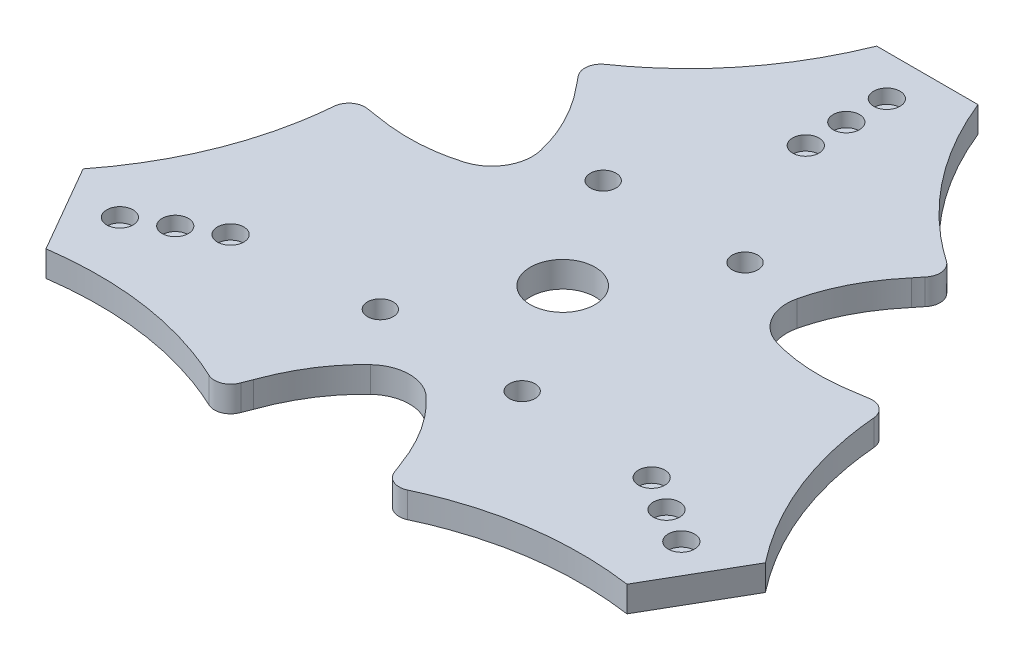
from build123d import *

# Parameters (mm, degrees)
CROQUIS2_R            = 16
DELTA_BASE_DEPTH      = 12.7
CROQUIS3_R            = 3
CORTAR_EXTRUIR2_DEPTH = 30
CROQUIS5_R            = 6.5
CORTAR_EXTRUIR3_DEPTH = 7
CROQUIS6_R            = 6.35
CORTAR_EXTRUIR4_DEPTH = 38


with BuildPart() as part:
    # Croquis2 → Delta Base (new body)
    with BuildSketch(Plane(origin=(0, 0, 0), x_dir=(1, 0, 0), z_dir=(0, 1, 0))):
        with BuildLine():
            Line((168.384572854, -68.349364766), (143.384572854, -111.650634955))
            add(Edge.make_bspline(
                [(143.384572854, -111.650634955), (110.228964472, -106.994880788), (78.165264136, -111.818792753), (48.966207304, -125.543555732)],
                knots=[0, 0, 0, 0, 0.911575674, 0.911575674, 0.911575674, 0.911575674], degree=3))
            ThreePointArc((48.966207304, -125.543555732), (42.399289585, -125.651302831), (37.964762468, -120.806616359))
            add(Edge.make_bspline(
                [(36.219139152, -116.360829974), (36.873200125, -117.787733164), (37.457762294, -119.267608258), (37.964762468, -120.806616359)],
                knots=[0.875206919, 0.875206919, 0.875206919, 0.875206919, 0.919288331, 0.919288331, 0.919288331, 0.919288331], degree=3))
            add(Edge.make_bspline(
                [(36.219139152, -116.360829974), (31.103863708, -102.135589346), (23.600584995, -90.366962092), (13.709301605, -81.054947485)],
                knots=[0, 0, 0, 0, 0.49880396, 0.49880396, 0.49880396, 0.49880396], degree=3))
            ThreePointArc((13.709301605, -81.054947485), (4.34e-07, -75.617057833), (-13.709300808, -81.054947304))
            add(Edge.make_bspline(
                [(-36.219138946, -116.360830332), (-31.103863897, -102.135589743), (-23.600584693, -90.366962129), (-13.709300808, -81.054947304)],
                knots=[0, 0, 0, 0, 0.498803969, 0.498803969, 0.498803969, 0.498803969], degree=3))
            add(Edge.make_bspline(
                [(-36.219138946, -116.360830332), (-36.873199918, -117.787733522), (-37.457762087, -119.267608616), (-37.964762261, -120.806616717)],
                knots=[0.875206919, 0.875206919, 0.875206919, 0.875206919, 0.919288331, 0.919288331, 0.919288331, 0.919288331], degree=3))
            ThreePointArc((-37.964762261, -120.806616717), (-42.399289378, -125.651303189), (-48.966207097, -125.543556091))
            add(Edge.make_bspline(
                [(-143.384572647, -111.650635314), (-110.228964266, -106.994881146), (-78.165263929, -111.818793111), (-48.966207097, -125.543556091)],
                knots=[0, 0, 0, 0, 0.911575674, 0.911575674, 0.911575674, 0.911575674], degree=3))
            Line((-143.384572647, -111.650635314), (-168.384572647, -68.349365124))
            add(Edge.make_bspline(
                [(-168.384572647, -68.349365124), (-147.774767073, -41.963643072), (-135.920547212, -11.783708059), (-133.207012198, 20.365798414)],
                knots=[0, 0, 0, 0, 0.911575674, 0.911575674, 0.911575674, 0.911575674], degree=3))
            ThreePointArc((-133.207012198, 20.365798414), (-130.016865062, 26.106789533), (-123.603979946, 27.524859434))
            add(Edge.make_bspline(
                [(-118.881004339, 26.813720378), (-120.443769236, 26.960738555), (-122.017659747, 27.194430413), (-123.603979946, 27.524859434)],
                knots=[0.875206919, 0.875206919, 0.875206919, 0.875206919, 0.919288331, 0.919288331, 0.919288331, 0.919288331], degree=3))
            add(Edge.make_bspline(
                [(-118.881004339, 26.813720378), (-104.003947343, 24.131058268), (-90.060377482, 24.744774797), (-77.05029433, 28.654870325)],
                knots=[0, 0, 0, 0, 0.49880396, 0.49880396, 0.49880396, 0.49880396], degree=3))
            ThreePointArc((-77.05029433, 28.654870325), (-65.486293205, 37.808528635), (-63.340993077, 52.400076525))
            add(Edge.make_bspline(
                [(-82.6618656, 89.547109596), (-72.900083398, 78.004530603), (-66.459792532, 65.622186774), (-63.340993077, 52.400076525)],
                knots=[0, 0, 0, 0, 0.498803968, 0.498803968, 0.498803968, 0.498803968], degree=3))
            add(Edge.make_bspline(
                [(-82.6618656, 89.547109596), (-83.570569526, 90.826994609), (-84.559897867, 92.073177844), (-85.639217892, 93.281756925)],
                knots=[0.875206919, 0.875206919, 0.875206919, 0.875206919, 0.919288331, 0.919288331, 0.919288331, 0.919288331], degree=3))
            ThreePointArc((-85.639217892, 93.281756925), (-87.617575891, 99.544513298), (-84.240805308, 105.177757318))
            add(Edge.make_bspline(
                [(-25.000000207, 180.00000008), (-37.545803015, 148.95852386), (-57.75528349, 123.602500812), (-84.240805308, 105.177757318)],
                knots=[0, 0, 0, 0, 0.911575674, 0.911575674, 0.911575674, 0.911575674], degree=3))
            Line((-25.000000207, 180.00000008), (24.999999793, 180.00000008))
            add(Edge.make_bspline(
                [(24.999999793, 180.00000008), (37.545802601, 148.95852386), (57.755283076, 123.602500812), (84.240804894, 105.177757318)],
                knots=[0, 0, 0, 0, 0.911575674, 0.911575674, 0.911575674, 0.911575674], degree=3))
            ThreePointArc((84.240804894, 105.177757318), (87.617575478, 99.544513298), (85.639217478, 93.281756925))
            add(Edge.make_bspline(
                [(82.661865187, 89.547109596), (83.570569112, 90.826994609), (84.559897453, 92.073177844), (85.639217478, 93.281756925)],
                knots=[0.875206919, 0.875206919, 0.875206919, 0.875206919, 0.919288331, 0.919288331, 0.919288331, 0.919288331], degree=3))
            add(Edge.make_bspline(
                [(82.661865187, 89.547109596), (72.90008315, 78.0045308), (66.459792337, 65.622187196), (63.340992822, 52.400077201)],
                knots=[0, 0, 0, 0, 0.49880396, 0.49880396, 0.49880396, 0.49880396], degree=3))
            ThreePointArc((63.340992822, 52.400077201), (65.486292826, 37.808529293), (77.050293872, 28.654870884))
            add(Edge.make_bspline(
                [(118.881004546, 26.813720736), (104.003947297, 24.131058581), (90.060377214, 24.744775176), (77.050293872, 28.654870884)],
                knots=[0, 0, 0, 0, 0.498803969, 0.498803969, 0.498803969, 0.498803969], degree=3))
            add(Edge.make_bspline(
                [(118.881004546, 26.813720736), (120.443769443, 26.960738913), (122.017659954, 27.194430772), (123.603980153, 27.524859792)],
                knots=[0.875206919, 0.875206919, 0.875206919, 0.875206919, 0.919288331, 0.919288331, 0.919288331, 0.919288331], degree=3))
            ThreePointArc((123.603980153, 27.524859792), (130.016865269, 26.106789891), (133.207012404, 20.365798772))
            add(Edge.make_bspline(
                [(168.384572854, -68.349364766), (147.77476728, -41.963642714), (135.920547419, -11.783707701), (133.207012404, 20.365798772)],
                knots=[0, 0, 0, 0, 0.911575674, 0.911575674, 0.911575674, 0.911575674], degree=3))
        make_face()
        with Locations(Location((-2.07e-07, 8e-08, 0), (0, 0, 270))):
            Circle(CROQUIS2_R, mode=Mode.SUBTRACT)
    extrude(amount=DELTA_BASE_DEPTH)

    # Croquis3 → Cortar-Extruir2 (cut)
    with BuildSketch(Plane(origin=(0, 12.7, 0), x_dir=(1, 0, 0), z_dir=(0, 1, 0))):
        with Locations(Location((0, 120, 0), (0, 0, 270))):
            Circle(CROQUIS3_R)
        with Locations(Location((0, 140, 0), (0, 0, 270))):
            Circle(CROQUIS3_R)
        with Locations(Location((0, 160, 0), (0, 0, 270))):
            Circle(CROQUIS3_R)
        with Locations(Location((103.923048454, -60, 0), (0, 0, 270))):
            Circle(CROQUIS3_R)
        with Locations(Location((121.24355653, -70, 0), (0, 0, 270))):
            Circle(CROQUIS3_R)
        with Locations(Location((138.564064606, -80, 0), (0, 0, 270))):
            Circle(CROQUIS3_R)
        with Locations(Location((-103.923048454, -60, 0), (0, 0, 270))):
            Circle(CROQUIS3_R)
        with Locations(Location((-121.24355653, -70, 0), (0, 0, 270))):
            Circle(CROQUIS3_R)
        with Locations(Location((-138.564064605, -80, 0), (0, 0, 270))):
            Circle(CROQUIS3_R)
    extrude(amount=-CORTAR_EXTRUIR2_DEPTH, mode=Mode.SUBTRACT)

    # Croquis5 → Cortar-Extruir3 (cut)
    with BuildSketch(Plane(origin=(0, 12.7, 0), x_dir=(1, 0, 0), z_dir=(0, 1, 0))):
        with Locations(Location((0, 160, 0), (0, 0, 270))):
            Circle(CROQUIS5_R)
        with Locations(Location((0, 140, 0), (0, 0, 270))):
            Circle(CROQUIS5_R)
        with Locations(Location((0, 120, 0), (0, 0, 270))):
            Circle(CROQUIS5_R)
        with Locations(Location((138.564064606, -80, 0), (0, 0, 270))):
            Circle(CROQUIS5_R)
        with Locations(Location((121.24355653, -70, 0), (0, 0, 270))):
            Circle(CROQUIS5_R)
        with Locations(Location((103.923048454, -60, 0), (0, 0, 270))):
            Circle(CROQUIS5_R)
        with Locations(Location((-138.564064606, -80, 0), (0, 0, 270))):
            Circle(CROQUIS5_R)
        with Locations(Location((-121.24355653, -70, 0), (0, 0, 270))):
            Circle(CROQUIS5_R)
        with Locations(Location((-103.923048454, -60, 0), (0, 0, 270))):
            Circle(CROQUIS5_R)
    extrude(amount=-CORTAR_EXTRUIR3_DEPTH, mode=Mode.SUBTRACT)

    # Croquis6 → Cortar-Extruir4 (cut)
    with BuildSketch(Plane(origin=(0, 12.7, 0), x_dir=(1, 0, 0), z_dir=(0, 1, 0))):
        with Locations(Location((-35, 55, 0), (0, 0, 270))):
            Circle(CROQUIS6_R)
        with Locations(Location((35, 55.00000008, 0), (0, 0, 270))):
            Circle(CROQUIS6_R)
        with Locations(Location((-35, -55, 0), (0, 0, 270))):
            Circle(CROQUIS6_R)
        with Locations(Location((35, -55, 0), (0, 0, 270))):
            Circle(CROQUIS6_R)
    extrude(amount=-CORTAR_EXTRUIR4_DEPTH, mode=Mode.SUBTRACT)


solid = part.part
